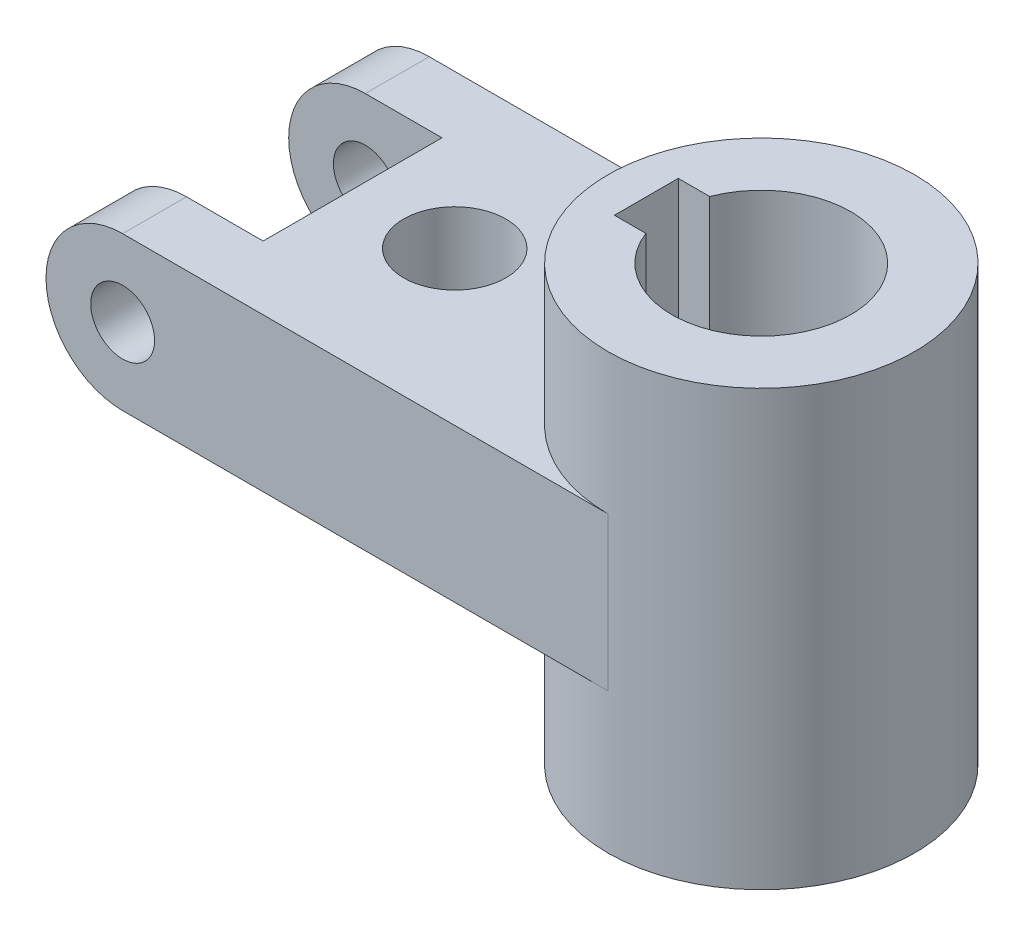
from build123d import *

# Parameters (mm, degrees)
BOSS_EXTRUDE1_DEPTH      = 17
BOSS_EXTRUDE1_DEPTH_BACK = 17
SKETCH1_R                = 12
BOSS_EXTRUDE2_DEPTH      = 6
BOSS_EXTRUDE2_DEPTH_BACK = 6
SKETCH1_3_R              = 4
SKETCH2_R                = 2.5
CUT_EXTRUDE1_DEPTH       = 45.955533586


with BuildPart() as part:
    # Sketch1 → Boss-Extrude1 (new, two sides: drawn at the far end of the back side and taken through both)
    with BuildSketch(Plane(origin=(0, 0, 0), x_dir=(1, 0, 0), z_dir=(0, 1, 0)).offset(-BOSS_EXTRUDE1_DEPTH_BACK)):
        with Locations((22, 0)):
            Circle(SKETCH1_R)
        with BuildLine():
            ThreePointArc((15.461651585, 2.5), (29, 0), (15.461651585, -2.5))
            Line((15.461651585, -2.5), (13, -2.5))
            Line((13, -2.5), (13, 2.5))
            Line((13, 2.5), (15.461651585, 2.5))
        make_face(mode=Mode.SUBTRACT)
    extrude(amount=BOSS_EXTRUDE1_DEPTH + BOSS_EXTRUDE1_DEPTH_BACK)

    # Sketch1<3> → Boss-Extrude2 (add, two sides: drawn at the far end of the back side and taken through both)
    with BuildSketch(Plane(origin=(0, 0, 0), x_dir=(1, 0, 0), z_dir=(0, 1, 0)).offset(-BOSS_EXTRUDE2_DEPTH_BACK)):
        with BuildLine():
            Line((-22, -7), (-22, -12))
            Line((-22, -12), (22, -12))
            ThreePointArc((22, -12), (10, 0), (22, 12))
            Line((22, 12), (-22, 12))
            Line((-22, 12), (-22, 7))
            Line((-22, 7), (-10, 7))
            Line((-10, 7), (-10, -7))
            Line((-10, -7), (-22, -7))
        make_face()
        with Locations((-2, 0)):
            Circle(SKETCH1_3_R, mode=Mode.SUBTRACT)
    extrude(amount=BOSS_EXTRUDE2_DEPTH + BOSS_EXTRUDE2_DEPTH_BACK)

    # Sketch2 → Cut-Extrude1 (cut, through all)
    with BuildSketch(Plane.XY.offset(12)):
        with BuildLine():
            Line((-16, 6), (-22, 6))
            Line((-22, 6), (-22, -5e-09))
            ThreePointArc((-22, -5e-09), (-20.242640689, 4.242640685), (-16, 6))
        make_face()
        with BuildLine():
            ThreePointArc((-16, -6), (-20.242640685, -4.242640689), (-22, -5e-09))
            Line((-22, -5e-09), (-22, -6))
            Line((-22, -6), (-16, -6))
        make_face()
        with Locations((-16, 0)):
            Circle(SKETCH2_R)
    extrude(amount=-CUT_EXTRUDE1_DEPTH, mode=Mode.SUBTRACT)


solid = part.part
